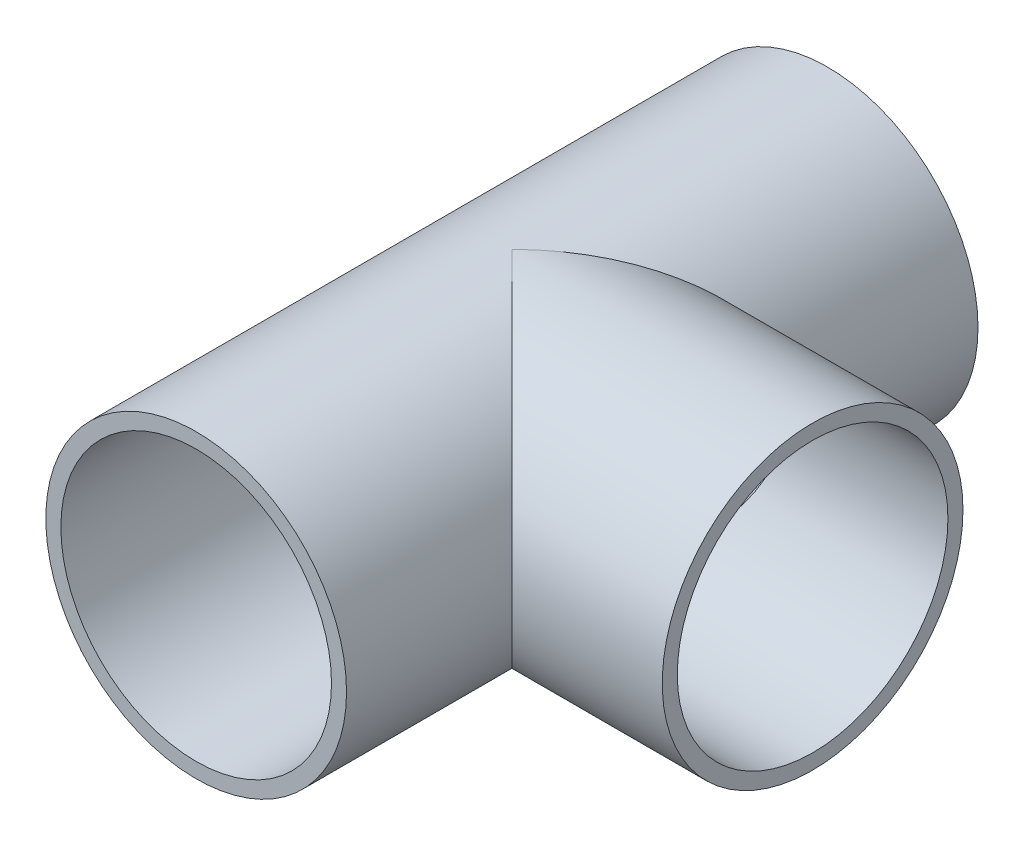
from build123d import *

# Parameters (mm, degrees)
SKETCH2_R           = 12.7
SKETCH2_R_2         = 11.43
BOSS_EXTRUDE1_DEPTH = 53.34
SKETCH3_R           = 12.7
SKETCH3_R_2         = 11.43
BOSS_EXTRUDE2_DEPTH = 12.7
BOSS_EXTRUDE3_START = 12.7
SKETCH4_R           = 12.7
SKETCH4_R_2         = 11.43
BOSS_EXTRUDE3_DEPTH = 12.7
SKETCH5_R           = 11.43
CUT_EXTRUDE1_DEPTH  = 25.4
SKETCH6_R           = 11.43
CUT_EXTRUDE2_DEPTH  = 61.428516577


with BuildPart() as part:
    # Sketch2 → Boss-Extrude1 (new body)
    with BuildSketch(Plane.XY):
        Circle(SKETCH2_R)
        Circle(SKETCH2_R_2, mode=Mode.SUBTRACT)
    extrude(amount=BOSS_EXTRUDE1_DEPTH)

    # Sketch3 → Boss-Extrude2 (add)
    with BuildSketch(Plane(origin=(12.7, 0, 0), x_dir=(0, 0, -1), z_dir=(1, 0, 0))):
        with Locations((-26.67, 0)):
            Circle(SKETCH3_R)
        with Locations((-26.67, 0)):
            Circle(SKETCH3_R_2, mode=Mode.SUBTRACT)
    extrude(amount=-BOSS_EXTRUDE2_DEPTH)

    # Sketch4 → Boss-Extrude3 (add)
    with BuildSketch(Plane(origin=(12.7, 0, 0), x_dir=(0, 0, -1), z_dir=(1, 0, 0)).offset(BOSS_EXTRUDE3_START)):
        with Locations((-26.67, 0)):
            Circle(SKETCH4_R)
        with Locations((-26.67, 0)):
            Circle(SKETCH4_R_2, mode=Mode.SUBTRACT)
    extrude(amount=-BOSS_EXTRUDE3_DEPTH)

    # Sketch5 → Cut-Extrude1 (cut)
    with BuildSketch(Plane(origin=(25.4, 0, 0), x_dir=(0, 0, -1), z_dir=(1, 0, 0))):
        with Locations((-26.67, 0)):
            Circle(SKETCH5_R)
    extrude(amount=-CUT_EXTRUDE1_DEPTH, mode=Mode.SUBTRACT)

    # Sketch6 → Cut-Extrude2 (cut, through all)
    with BuildSketch(Plane(origin=(0, 0, 0), x_dir=(-1, 0, 0), z_dir=(0, 0, -1))):
        with Locations(Location((0, 0, 0), (0, 0, 180))):
            Circle(SKETCH6_R)
    extrude(amount=-CUT_EXTRUDE2_DEPTH, mode=Mode.SUBTRACT)


solid = part.part
